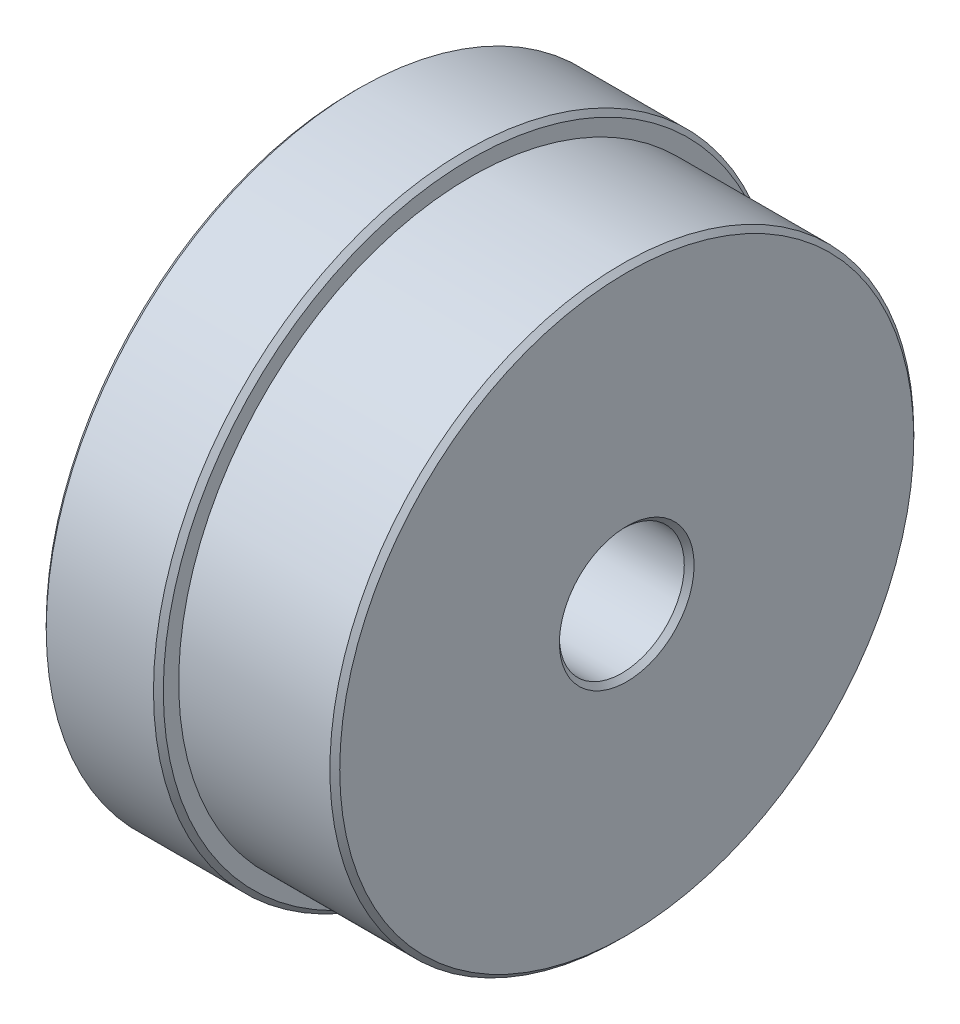
from build123d import *

# Parameters (mm, degrees)
SKETCH1_R           = 23.749
BOSS_EXTRUDE1_DEPTH = 12.7
SKETCH2_R           = 25.4
BOSS_EXTRUDE2_DEPTH = 9.525
SKETCH3_R           = 11.1125
CUT_EXTRUDE1_DEPTH  = 7.112
SKETCH4_R           = 7.27458794
CUT_EXTRUDE2_DEPTH  = 0.2
SKETCH5_R           = 5.08
CUT_EXTRUDE3_DEPTH  = 39.893670038
CHAMFER1_SIZE       = 0.4


with BuildPart() as part:
    # Sketch1 → Boss-Extrude1 (new body)
    with BuildSketch(Plane(origin=(0, 0, 0), x_dir=(0, 0, -1), z_dir=(1, 0, 0))):
        Circle(SKETCH1_R)
    extrude(amount=BOSS_EXTRUDE1_DEPTH)

    # Sketch2 → Boss-Extrude2 (add)
    with BuildSketch(Plane.ZY):
        with Locations(Location((0, 0, 0), (0, 0, 180))):
            Circle(SKETCH2_R)
    extrude(amount=BOSS_EXTRUDE2_DEPTH)

    # Sketch3 → Cut-Extrude1 (cut)
    with BuildSketch(Plane.ZY.offset(9.525)):
        Circle(SKETCH3_R)
    extrude(amount=-CUT_EXTRUDE1_DEPTH, mode=Mode.SUBTRACT)

    # Sketch4 → Cut-Extrude2 (cut)
    with BuildSketch(Plane.ZY.offset(2.413)):
        Circle(SKETCH4_R)
    extrude(amount=-CUT_EXTRUDE2_DEPTH, mode=Mode.SUBTRACT)

    # Sketch5 → Cut-Extrude3 (cut, through all)
    with BuildSketch(Plane.ZY.offset(2.213)):
        Circle(SKETCH5_R)
    extrude(amount=-CUT_EXTRUDE3_DEPTH, mode=Mode.SUBTRACT)

    # Chamfer1
    chamfer1_edges = [part.edges().sort_by_distance(p)[0] for p in [
        (-9.525, 0, -11.1125),
        (12.7, 0, -5.08),
        (12.7, 0, 23.749),
        (0, 0, 25.4),
        (-9.525, 0, 25.4),
    ]]
    chamfer(chamfer1_edges, length=CHAMFER1_SIZE)


solid = part.part
